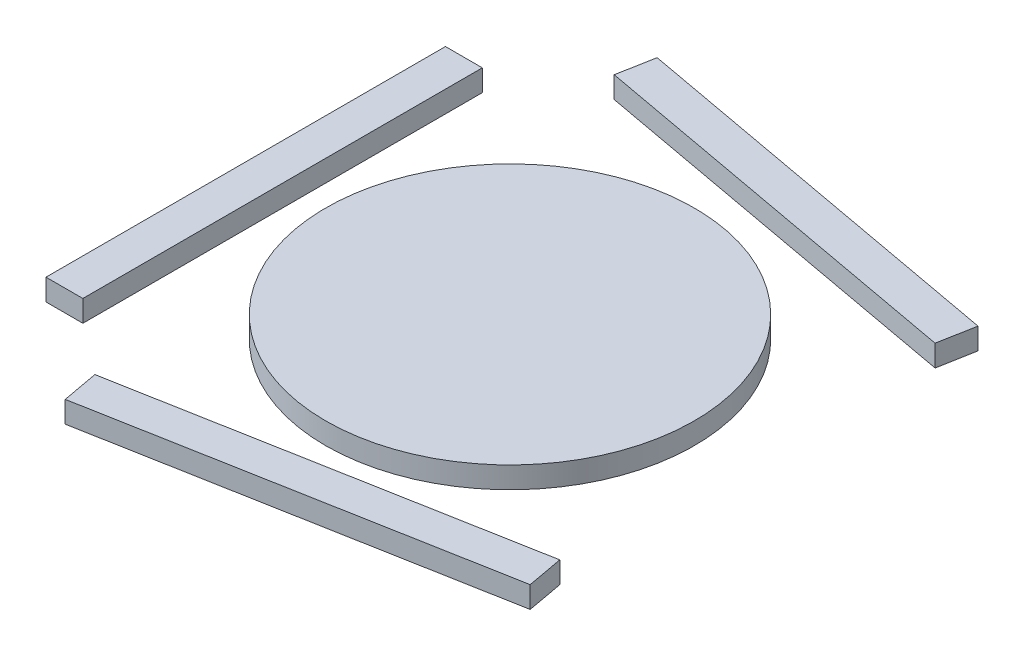
from build123d import *

# Parameters (mm, degrees)
SKETCH1_R             = 300
BOSS_EXTRUDE1_DEPTH   = 35
BOSS_EXTRUDE1_2_DEPTH = 35
SKETCH1_W             = 60
SKETCH1_H             = 650
BOSS_EXTRUDE1_3_DEPTH = 35
BOSS_EXTRUDE1_4_DEPTH = 35


with BuildPart() as part:
    # Sketch1 → Boss-Extrude1 (new body)
    with BuildSketch(Plane(origin=(0, 0, 0), x_dir=(1, 0, 0), z_dir=(0, 1, 0))):
        with Locations(Location((0, 0, 0), (0, 0, 270))):
            Circle(SKETCH1_R)
    extrude(amount=BOSS_EXTRUDE1_DEPTH)


with BuildPart() as body_2:
    # Sketch1 → Boss-Extrude1 2 (new body)
    with BuildSketch(Plane(origin=(0, 0, 0), x_dir=(1, 0, 0), z_dir=(0, 1, 0))):
        Polygon((386.393442623, 305.327868852), (-252.950819672, 422.540983607), (-242.131147541, 481.557377049), (397.213114754, 364.344262295), align=None)
    extrude(amount=BOSS_EXTRUDE1_2_DEPTH)


with BuildPart() as body_3:
    # Sketch1 → Boss-Extrude1 3 (new body)
    with BuildSketch(Plane(origin=(0, 0, 0), x_dir=(1, 0, 0), z_dir=(0, 1, 0))):
        with Locations((-400, 0)):
            Rectangle(SKETCH1_W, SKETCH1_H)
    extrude(amount=BOSS_EXTRUDE1_3_DEPTH)


with BuildPart() as body_4:
    # Sketch1 → Boss-Extrude1 4 (new body)
    with BuildSketch(Plane(origin=(0, 0, 0), x_dir=(1, 0, 0), z_dir=(0, 1, 0))):
        Polygon((-242.131147541, -481.557377049), (-252.950819672, -422.540983607), (386.393442623, -305.327868852), (397.213114754, -364.344262295), align=None)
    extrude(amount=BOSS_EXTRUDE1_4_DEPTH)


solid = Compound([part.part, body_2.part, body_3.part, body_4.part])
